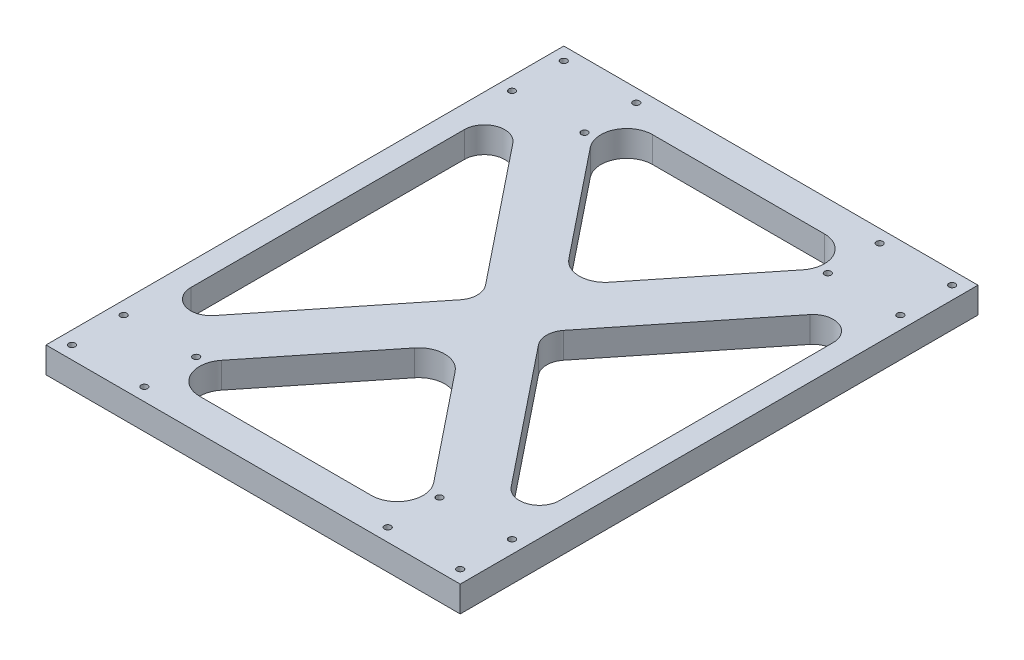
from build123d import *

# Parameters (mm, degrees)
ORIGINAL_EXTRUSTION_DEPTH            = 12.7
HOLES_FOR_WHEELS_TO_MOUNT_DEPTH      = 164.134453749
HOLES_FOR_WHEELS_TO_MOUNT_DEPTH_BACK = 164.134453749
SKETCH2_R                            = 1.6


with BuildPart() as part:
    # Sketch1 → Original Extrustion (new body)
    # profile 1 of 4: a face of its own
    with BuildSketch(Plane(origin=(0, 0, 0), x_dir=(1, 0, 0), z_dir=(0, 1, 0))):
        Polygon((-101.6, 127), (0, 0), (101.6, 127), align=None)
        with BuildLine():
            ThreePointArc((-42.146144983, 111.125), (-53.592696084, 103.926496877), (-52.063178863, 90.491372896))
            Line((-52.063178863, 90.491372896), (-9.91703388, 37.808691667))
            ThreePointArc((-9.91703388, 37.808691667), (0, 33.042318771), (9.91703388, 37.808691667))
            Line((9.91703388, 37.808691667), (52.063178863, 90.491372896))
            ThreePointArc((52.063178863, 90.491372896), (53.592696084, 103.926496877), (42.146144983, 111.125))
            Line((42.146144983, 111.125), (-42.146144983, 111.125))
        make_face(mode=Mode.SUBTRACT)
    # profile 2 of 4: a face of its own
    with BuildSketch(Plane(origin=(0, 0, 0), x_dir=(1, 0, 0), z_dir=(0, 1, 0))):
        Polygon((0, 0), (-101.6, -127), (-101.6, 127), align=None)
        with BuildLine():
            Line((-90.4875, -67.080858304), (-90.4875, 67.080858304))
            ThreePointArc((-90.4875, 67.080858304), (-83.860454762, 76.428440433), (-72.846213574, 73.269087445))
            Line((-72.846213574, 73.269087445), (-19.181526931, 6.188229141))
            ThreePointArc((-19.181526931, 6.188229141), (-17.010813357, 0), (-19.181526931, -6.188229141))
            Line((-19.181526931, -6.188229141), (-72.846213574, -73.269087445))
            ThreePointArc((-72.846213574, -73.269087445), (-83.860454762, -76.428440433), (-90.4875, -67.080858304))
        make_face(mode=Mode.SUBTRACT)
    # profile 3 of 4: a face of its own
    with BuildSketch(Plane(origin=(0, 0, 0), x_dir=(1, 0, 0), z_dir=(0, 1, 0))):
        Polygon((-101.6, -127), (101.6, -127), (0, 0), align=None)
        with BuildLine():
            Line((-42.146144983, -111.125), (42.146144983, -111.125))
            ThreePointArc((42.146144983, -111.125), (53.592696084, -103.926496877), (52.063178863, -90.491372896))
            Line((52.063178863, -90.491372896), (9.91703388, -37.808691667))
            ThreePointArc((9.91703388, -37.808691667), (0, -33.042318771), (-9.91703388, -37.808691667))
            Line((-9.91703388, -37.808691667), (-52.063178863, -90.491372896))
            ThreePointArc((-52.063178863, -90.491372896), (-53.592696084, -103.926496877), (-42.146144983, -111.125))
        make_face(mode=Mode.SUBTRACT)
    # profile 4 of 4: a face of its own
    with BuildSketch(Plane(origin=(0, 0, 0), x_dir=(1, 0, 0), z_dir=(0, 1, 0))):
        Polygon((101.6, -127), (0, 0), (101.6, 127), align=None)
        with BuildLine():
            ThreePointArc((72.846213574, -73.269087445), (83.860454762, -76.428440433), (90.4875, -67.080858304))
            Line((90.4875, -67.080858304), (90.4875, 67.080858304))
            ThreePointArc((90.4875, 67.080858304), (83.860454762, 76.428440433), (72.846213574, 73.269087445))
            Line((72.846213574, 73.269087445), (19.181526931, 6.188229141))
            ThreePointArc((19.181526931, 6.188229141), (17.010813357, 0), (19.181526931, -6.188229141))
            Line((19.181526931, -6.188229141), (72.846213574, -73.269087445))
        make_face(mode=Mode.SUBTRACT)
    extrude(amount=ORIGINAL_EXTRUSTION_DEPTH)

    # Sketch2 → Holes for Wheels to mount (cut, two sides: drawn at the far end of the back side and taken through both)
    with BuildSketch(Plane(origin=(0, 12.7, 0), x_dir=(1, 0, 0), z_dir=(0, 1, 0)).offset(-HOLES_FOR_WHEELS_TO_MOUNT_DEPTH_BACK)):
        with Locations(Location((-95.25, 120.65, 0), (0, 0, 270))):
            Circle(SKETCH2_R)
        with Locations(Location((-59.69, 120.65, 0), (0, 0, 270))):
            Circle(SKETCH2_R)
        with Locations(Location((-95.25, 95.25, 0), (0, 0, 270))):
            Circle(SKETCH2_R)
        with Locations(Location((-59.69, 95.25, 0), (0, 0, 270))):
            Circle(SKETCH2_R)
        with Locations(Location((-95.25, -95.25, 0), (0, 0, 270))):
            Circle(SKETCH2_R)
        with Locations(Location((-59.69, -95.25, 0), (0, 0, 270))):
            Circle(SKETCH2_R)
        with Locations(Location((-95.25, -120.65, 0), (0, 0, 270))):
            Circle(SKETCH2_R)
        with Locations(Location((-59.69, -120.65, 0), (0, 0, 270))):
            Circle(SKETCH2_R)
        with Locations(Location((59.69, -95.25, 0), (0, 0, 270))):
            Circle(SKETCH2_R)
        with Locations(Location((95.25, -95.25, 0), (0, 0, 270))):
            Circle(SKETCH2_R)
        with Locations(Location((59.69, -120.65, 0), (0, 0, 270))):
            Circle(SKETCH2_R)
        with Locations(Location((95.25, -120.65, 0), (0, 0, 270))):
            Circle(SKETCH2_R)
        with Locations(Location((59.69, 120.65, 0), (0, 0, 270))):
            Circle(SKETCH2_R)
        with Locations(Location((59.69, 95.25, 0), (0, 0, 270))):
            Circle(SKETCH2_R)
        with Locations(Location((95.25, 95.25, 0), (0, 0, 270))):
            Circle(SKETCH2_R)
        with Locations(Location((95.25, 120.65, 0), (0, 0, 270))):
            Circle(SKETCH2_R)
    extrude(amount=HOLES_FOR_WHEELS_TO_MOUNT_DEPTH + HOLES_FOR_WHEELS_TO_MOUNT_DEPTH_BACK, mode=Mode.SUBTRACT)


solid = part.part
